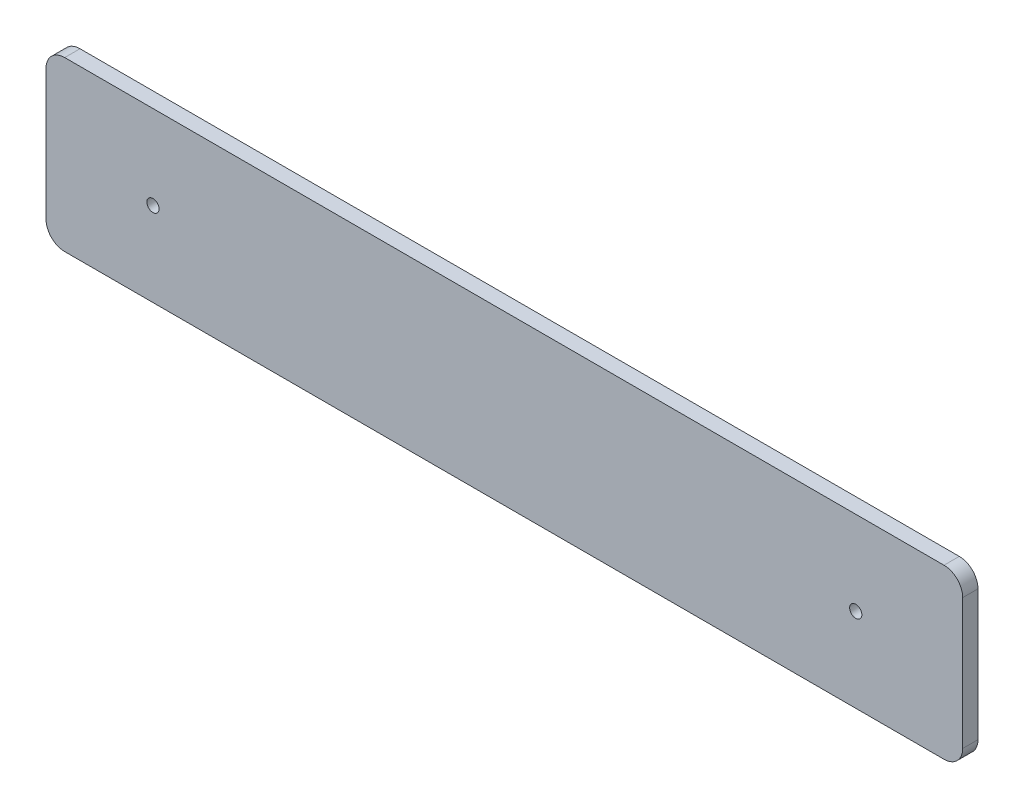
from build123d import *

# Parameters (mm, degrees)
SKETCH2_R           = 0.4
BOSS_EXTRUDE1_DEPTH = 1


with BuildPart() as part:
    # Sketch2 → Boss-Extrude1 (new body)
    with BuildSketch(Plane.XY):
        with BuildLine():
            Line((1.224709635, 0), (58.775290365, 0))
            ThreePointArc((58.775290365, 0), (59.641290853, -0.358709147), (60, -1.224709635))
            Line((60, -1.224709635), (60, -9.775290365))
            ThreePointArc((60, -9.775290365), (59.641290853, -10.641290853), (58.775290365, -11))
            Line((58.775290365, -11), (1.224709635, -11))
            ThreePointArc((1.224709635, -11), (0.358709147, -10.641290853), (0, -9.775290365))
            Line((0, -9.775290365), (0, -1.224709635))
            ThreePointArc((0, -1.224709635), (0.358709147, -0.358709147), (1.224709635, 0))
        make_face()
        with Locations((7, -5.5)):
            Circle(SKETCH2_R, mode=Mode.SUBTRACT)
        with Locations(Location((53, -5.5, 0), (0, 0, 180))):
            Circle(SKETCH2_R, mode=Mode.SUBTRACT)
    extrude(amount=BOSS_EXTRUDE1_DEPTH)


solid = part.part
